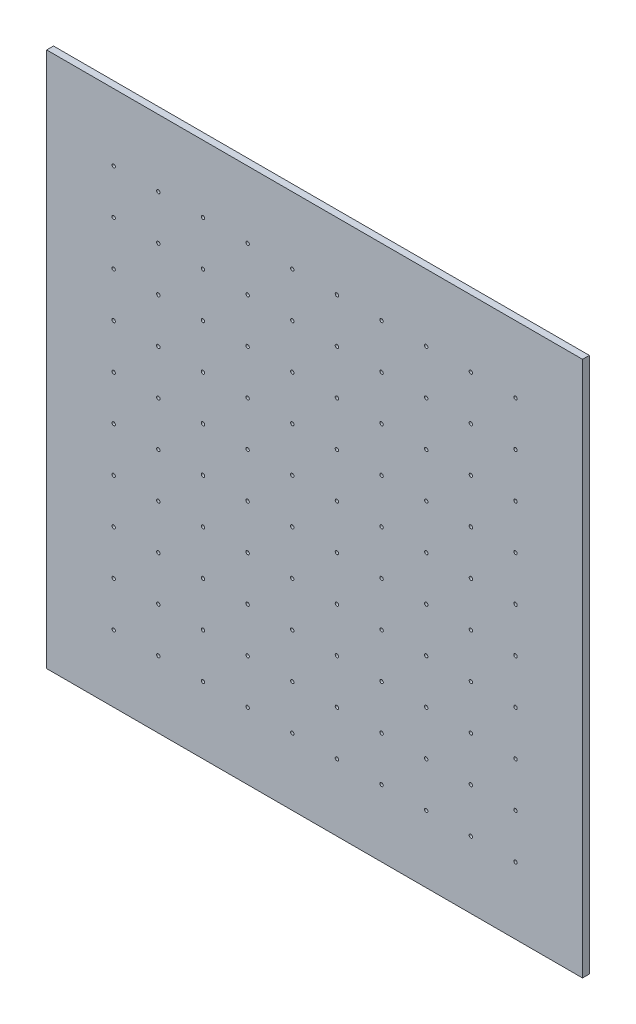
from build123d import *

# Parameters (mm, degrees)
SKETCH1_W            = 1500
SKETCH1_H            = 1500
BOSS_EXTRUDE1_DEPTH  = 9.525
SKETCH2_R            = 4.7625
CUT_EXTRUDE1_DEPTH   = 1061.831231865
LPATTERN1_COUNT      = 10
LPATTERN1_PITCH      = 125
LPATTERN1_COUNT_DIR2 = 10
LPATTERN1_PITCH_DIR2 = 125


with BuildPart() as part:
    # Sketch1 → Boss-Extrude1 (new, symmetric)
    with BuildSketch(Plane.XY):
        Rectangle(SKETCH1_W, SKETCH1_H)
    extrude(amount=BOSS_EXTRUDE1_DEPTH, both=True)

    # Sketch2 → Cut-Extrude1 (cut, through all)
    with BuildSketch(Plane.XY.offset(9.525)):
        with Locations((-562.5, 562.5)):
            Circle(SKETCH2_R)
    cut_extrude1 = extrude(amount=-CUT_EXTRUDE1_DEPTH, mode=Mode.SUBTRACT)

    # LPattern1: Cut-Extrude1 10 × 10
    with Locations(*[(j * LPATTERN1_PITCH_DIR2, -i * LPATTERN1_PITCH, 0) for i in range(LPATTERN1_COUNT) for j in range(LPATTERN1_COUNT_DIR2) if (i, j) != (0, 0)]):
        add(cut_extrude1, mode=Mode.SUBTRACT)


solid = part.part
